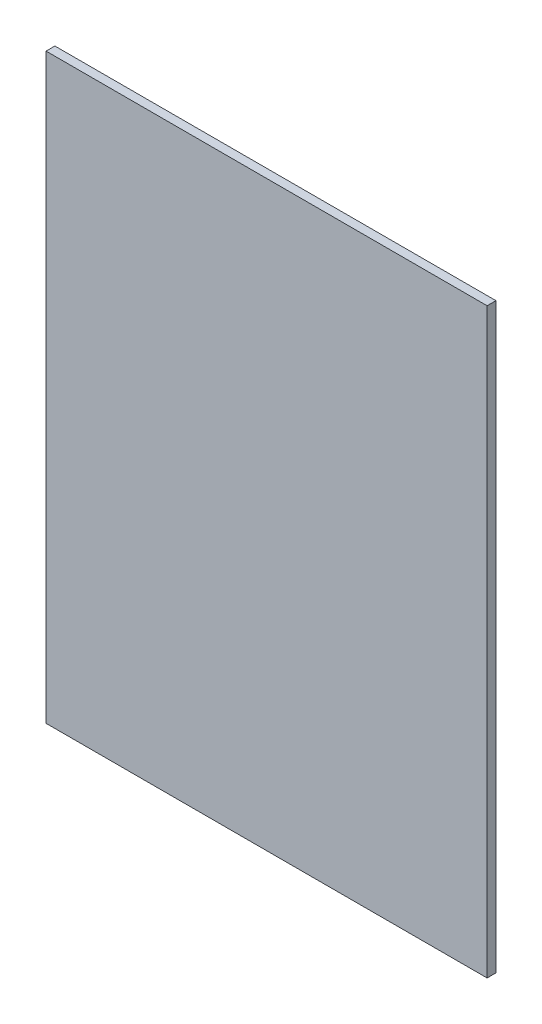
from build123d import *

# Parameters (mm, degrees)
SKETCH_1_W      = 50
SKETCH_1_H      = 66
EXTRUDE_1_DEPTH = 1


with BuildPart() as part:
    # 草图1 → 凸台-拉伸1 (new body)
    with BuildSketch(Plane.XY):
        with Locations((-6.369369369, -6.840840841)):
            Rectangle(SKETCH_1_W, SKETCH_1_H)
    extrude(amount=EXTRUDE_1_DEPTH)


solid = part.part
